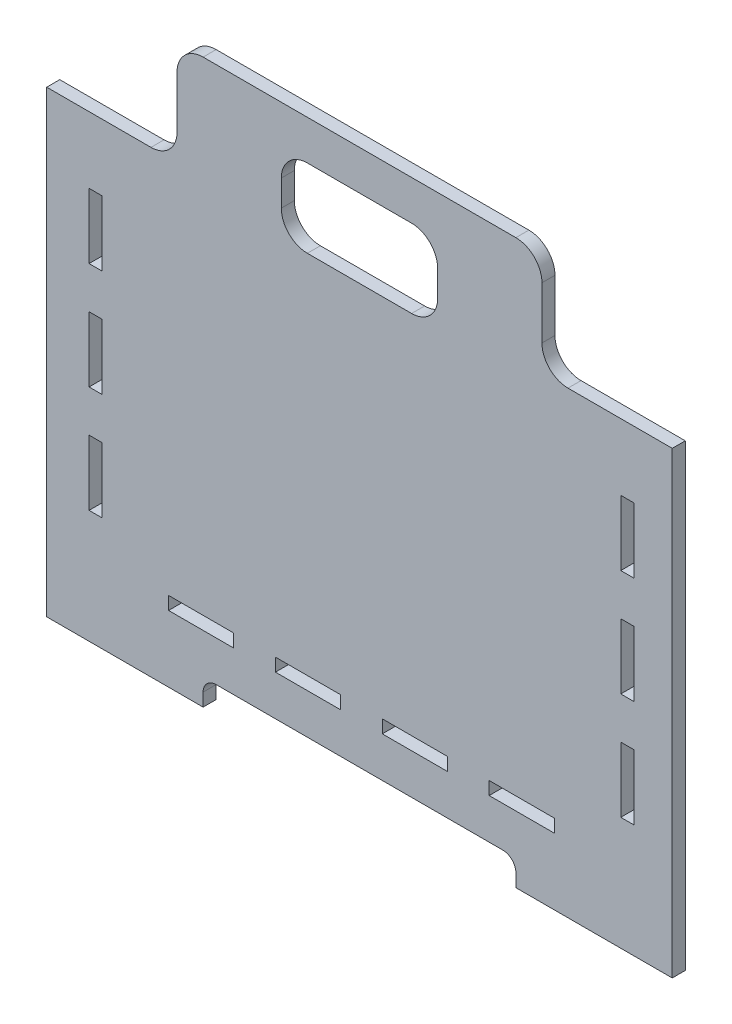
from build123d import *

# Parameters (mm, degrees)
BOSS_EXTRUDE1_DEPTH = 5
SKETCH2_W           = 5
SKETCH2_H           = 25
CUT_EXTRUDE1_DEPTH  = 164.135403883
FILLET1_R           = 10
SKETCH3_W           = 25
SKETCH3_H           = 5
CUT_EXTRUDE2_DEPTH  = 10
SKETCH4_W           = 60
SKETCH4_H           = 30
CUT_EXTRUDE3_DEPTH  = 35
FILLET2_R           = 10


with BuildPart() as part:
    # Sketch1 → Boss-Extrude1 (new body)
    with BuildSketch(Plane.XY):
        with BuildLine():
            Line((60, -105.6), (120, -105.6))
            Line((120, -105.6), (120, 70.4))
            Line((120, 70.4), (80, 70.4))
            ThreePointArc((80, 70.4), (72.928932188, 73.328932188), (70, 80.4))
            Line((70, 80.4), (70, 110.4))
            Line((70, 110.4), (-70, 110.4))
            Line((-70, 110.4), (-70, 80.4))
            ThreePointArc((-70, 80.4), (-72.928932188, 73.328932188), (-80, 70.4))
            Line((-80, 70.4), (-120, 70.4))
            Line((-120, 70.4), (-120, -105.6))
            Line((-120, -105.6), (-60, -105.6))
            Line((-60, -105.6), (-60, -100.6))
            ThreePointArc((-60, -100.6), (-58.535533906, -97.064466094), (-55, -95.6))
            Line((-55, -95.6), (55, -95.6))
            ThreePointArc((55, -95.6), (58.535533906, -97.064466094), (60, -100.6))
            Line((60, -100.6), (60, -105.6))
        make_face()
    extrude(amount=BOSS_EXTRUDE1_DEPTH)

    # Sketch2 → Cut-Extrude1 (cut, through all)
    with BuildSketch(Plane.XY.offset(5)):
        with Locations((102.75, 32.41)):
            Rectangle(SKETCH2_W, SKETCH2_H)
        with Locations((102.75, -8.59)):
            Rectangle(SKETCH2_W, SKETCH2_H)
        with Locations((102.75, -49.59)):
            Rectangle(SKETCH2_W, SKETCH2_H)
        with Locations((-101.25, 32.41)):
            Rectangle(SKETCH2_W, SKETCH2_H)
        with Locations((-101.25, -8.59)):
            Rectangle(SKETCH2_W, SKETCH2_H)
        with Locations((-101.25, -49.59)):
            Rectangle(SKETCH2_W, SKETCH2_H)
    extrude(amount=-CUT_EXTRUDE1_DEPTH, mode=Mode.SUBTRACT)

    # Fillet1
    fillet1_edges = [part.edges().sort_by_distance(p)[0] for p in [
        (-70, 110.4, 2.5),
        (70, 110.4, 2.5),
    ]]
    fillet(fillet1_edges, radius=FILLET1_R)

    # Sketch3 → Cut-Extrude2 (cut)
    with BuildSketch(Plane.XY.offset(5)):
        with Locations((62.25, -77.6)):
            Rectangle(SKETCH3_W, SKETCH3_H)
        with Locations((21.25, -77.6)):
            Rectangle(SKETCH3_W, SKETCH3_H)
        with Locations((-19.75, -77.6)):
            Rectangle(SKETCH3_W, SKETCH3_H)
        with Locations((-60.75, -77.6)):
            Rectangle(SKETCH3_W, SKETCH3_H)
    extrude(amount=-CUT_EXTRUDE2_DEPTH, mode=Mode.SUBTRACT)

    # Sketch4 → Cut-Extrude3 (cut)
    with BuildSketch(Plane.XY.offset(5)):
        with Locations((0, 80.204694575)):
            Rectangle(SKETCH4_W, SKETCH4_H)
    extrude(amount=-CUT_EXTRUDE3_DEPTH, mode=Mode.SUBTRACT)

    # Fillet2
    fillet2_edges = [part.edges().sort_by_distance(p)[0] for p in [
        (-30, 65.204694575, 2.5),
        (-30, 95.204694575, 2.5),
        (30, 95.204694575, 2.5),
        (30, 65.204694575, 2.5),
    ]]
    fillet(fillet2_edges, radius=FILLET2_R)


solid = part.part
